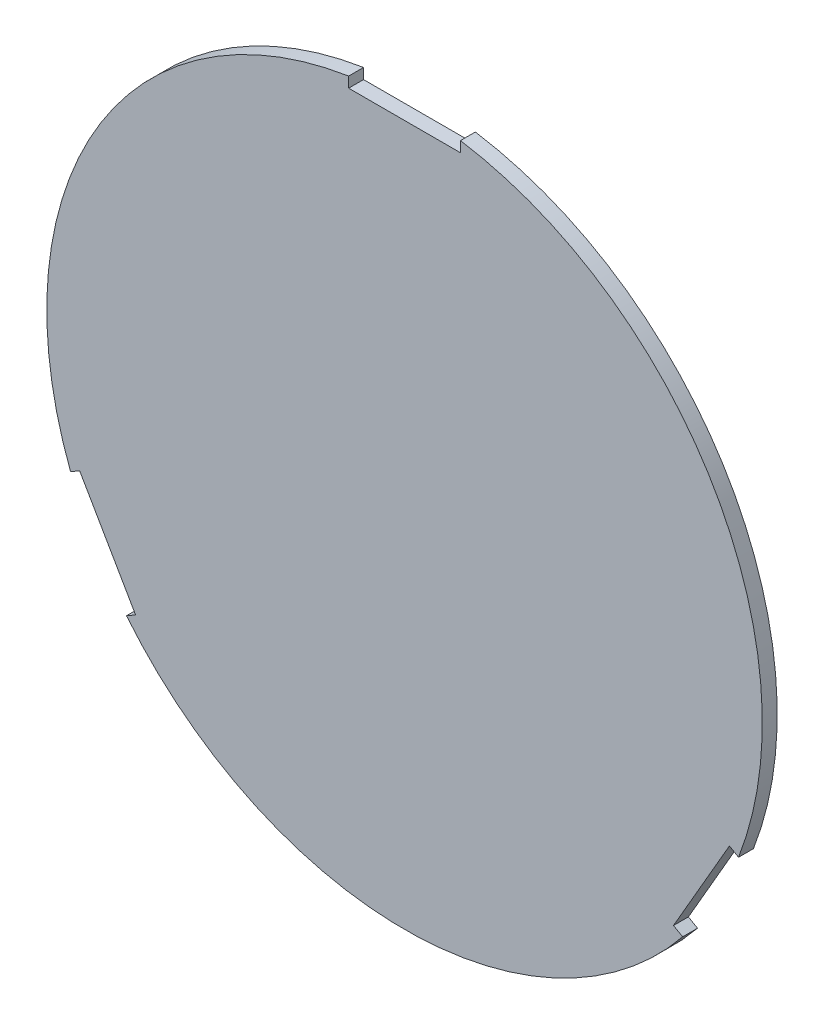
from build123d import *

# Parameters (mm, degrees)
EXTRUDE_1_DEPTH = 2


with BuildPart() as part:
    # Эскиз1 → Бобышка-Вытянуть1 (new body)
    with BuildSketch(Plane.XY):
        with BuildLine():
            Line((43.587168574, -16.504809472), (44.80864708, -17.210030416))
            ThreePointArc((44.80864708, -17.210030416), (47.195418527, -8.751712409), (48, 0))
            ThreePointArc((48, 0), (36.496575182, 31.176914536), (7.5, 47.410441888))
            Line((7.5, 47.410441888), (7.5, 46))
            Line((7.5, 46), (-7.5, 46))
            Line((-7.5, 46), (-7.5, 47.410441888))
            ThreePointArc((-7.5, 47.410441888), (-41.569219382, 24), (-44.80864708, -17.210030416))
            Line((-44.80864708, -17.210030416), (-43.587168574, -16.504809472))
            Line((-43.587168574, -16.504809472), (-36.087168574, -29.495190528))
            Line((-36.087168574, -29.495190528), (-37.30864708, -30.200411472))
            ThreePointArc((-37.30864708, -30.200411472), (0, -48), (37.30864708, -30.200411472))
            Line((37.30864708, -30.200411472), (36.087168574, -29.495190528))
            Line((36.087168574, -29.495190528), (43.587168574, -16.504809472))
        make_face()
    extrude(amount=EXTRUDE_1_DEPTH)


solid = part.part
